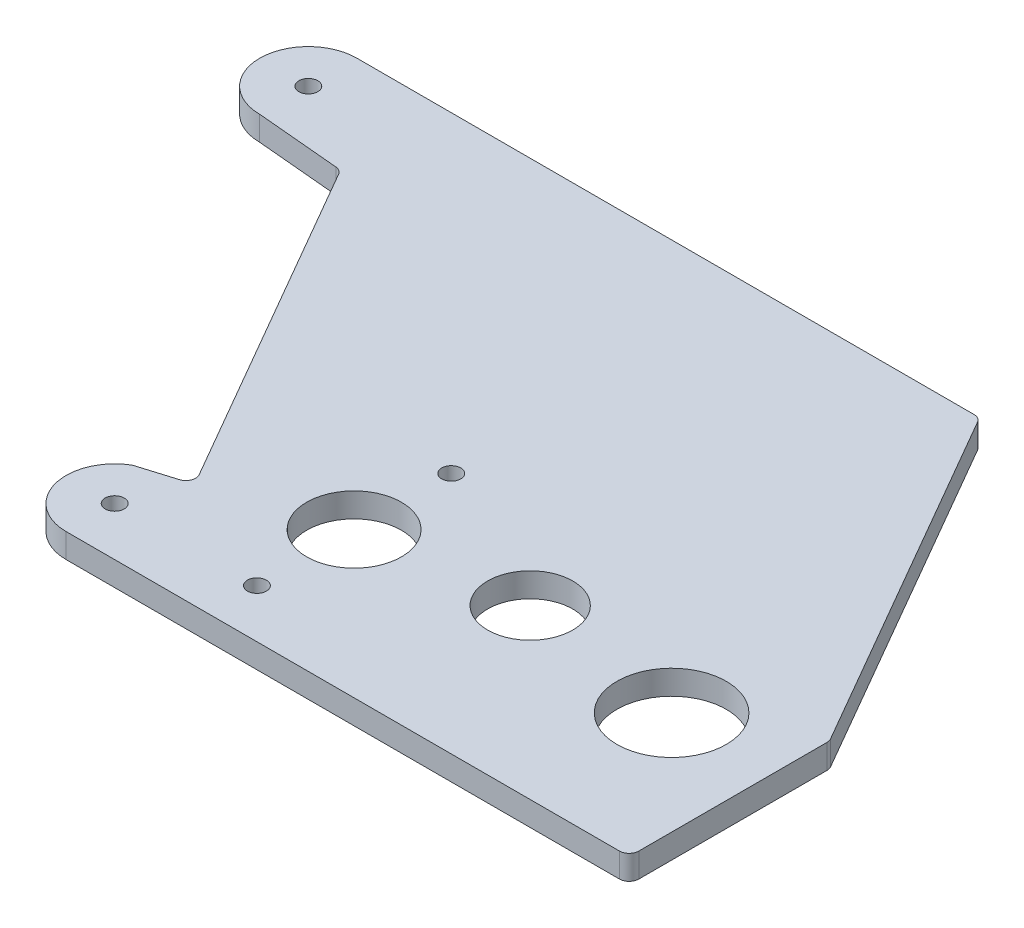
from build123d import *

# Parameters (mm, degrees)
SKETCH1_R           = 2.4892
SKETCH1_R_2         = 14.3002
SKETCH1_R_3         = 11.1252
SKETCH1_R_4         = 12.3825
BOSS_EXTRUDE1_DEPTH = 6.35
CUT_EXTRUDE3_DEPTH  = 196.570791382
FILLET2_R           = 2.54


with BuildPart() as part:
    # Sketch1 → Boss-Extrude1 (new body)
    with BuildSketch(Plane(origin=(0, 0, 0), x_dir=(1, 0, 0), z_dir=(0, 1, 0))):
        with BuildLine():
            ThreePointArc((-168.788743889, 72.590962133), (-181.488743889, 59.890962122), (-168.788743866, 47.190962133))
            Line((-168.788743866, 47.190962133), (-145.58139547, 45.094655563))
            Line((-145.58139547, 45.094655563), (-93.510572414, -45.094655563))
            Line((-93.510572414, -45.094655563), (-105.98261767, -48.892439505))
            ThreePointArc((-105.98261767, -48.892439505), (-111.899875664, -63.177964006), (-99.63261767, -72.590962133))
            Line((-99.63261767, -72.590962133), (47.56445351, -72.590962133))
            Line((47.56445351, -72.590962133), (47.56445351, 72.590962133))
            Line((47.56445351, 72.590962133), (-168.788743889, 72.590962133))
        make_face()
        with Locations(Location((-168.788743889, 59.890962133, 0), (0, 0, 270))):
            Circle(SKETCH1_R, mode=Mode.SUBTRACT)
        with Locations(Location((20.56425351, -34.490962133, 0), (0, 0, 270))):
            Circle(SKETCH1_R_2, mode=Mode.SUBTRACT)
        with Locations(Location((-22.22178223, -28.671379192, 0), (0, 0, 270))):
            Circle(SKETCH1_R_3, mode=Mode.SUBTRACT)
        with Locations(Location((-62.44294649, -9.090962133, 0), (0, 0, 270))):
            Circle(SKETCH1_R, mode=Mode.SUBTRACT)
        with Locations(Location((-62.44294649, -34.490962133, 0), (0, 0, 270))):
            Circle(SKETCH1_R_4, mode=Mode.SUBTRACT)
        with Locations(Location((-62.44294649, -59.890962133, 0), (0, 0, 270))):
            Circle(SKETCH1_R, mode=Mode.SUBTRACT)
        with Locations(Location((-99.63261767, -59.890962133, 0), (0, 0, 270))):
            Circle(SKETCH1_R, mode=Mode.SUBTRACT)
    extrude(amount=BOSS_EXTRUDE1_DEPTH)

    # Sketch3 → Cut-Extrude3 (cut, through all)
    with BuildSketch(Plane(origin=(0, 6.35, 0), x_dir=(1, 0, 0), z_dir=(0, 1, 0))):
        Polygon((47.56445351, -20.190762133), (-6.003099971, 72.590962133), (47.56445351, 72.590962133), align=None)
    extrude(amount=-CUT_EXTRUDE3_DEPTH, mode=Mode.SUBTRACT)

    # Fillet2
    fillet2_edges = [part.edges().sort_by_distance(p)[0] for p in [
        (-93.510572414, 3.175, 45.094655563),
        (-145.58139547, 3.175, -45.094655563),
        (47.56445351, 3.175, 72.590962133),
        (47.56445351, 3.175, 20.190762133),
        (-6.003099971, 3.175, -72.590962133),
    ]]
    fillet(fillet2_edges, radius=FILLET2_R)


solid = part.part
